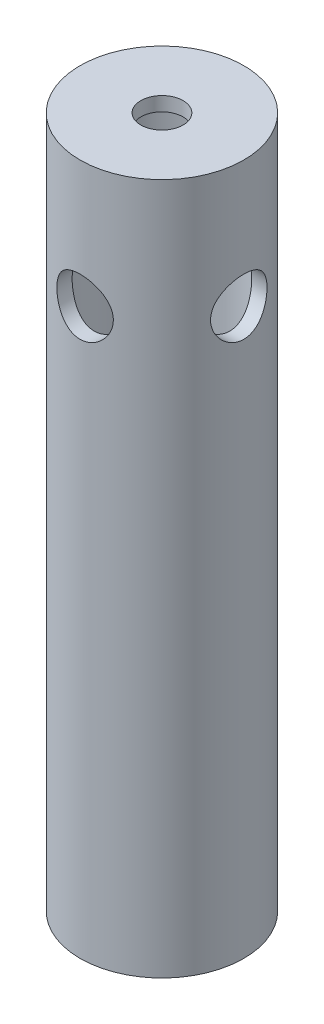
from build123d import *

# Parameters (mm, degrees)
SKETCH1_R           = 5.8
BOSS_EXTRUDE1_DEPTH = 49
SHELL2_T            = -1
SKETCH5_R           = 2
CUT_EXTRUDE1_DEPTH  = 50.681787407
CIRPATTERN1_COUNT   = 2
CIRPATTERN1_ANGLE   = 90
CUT_EXTRUDE2_REACH  = 51.682
SKETCH6_R           = 1.5


with BuildPart() as part:
    # Sketch1 → Boss-Extrude1 (new body)
    with BuildSketch(Plane(origin=(0, 0, 0), x_dir=(1, 0, 0), z_dir=(0, 1, 0))):
        with Locations(Location((0, 0, 0), (0, 0, 270))):
            Circle(SKETCH1_R)
    extrude(amount=BOSS_EXTRUDE1_DEPTH)

    # Shell2
    shell2_openings = [part.faces().sort_by_distance(p)[0] for p in [
        (0, 0, 0),
    ]]
    offset(amount=SHELL2_T, openings=shell2_openings, kind=Kind.INTERSECTION)

    # Sketch5 → Cut-Extrude1 (cut, symmetric)
    with BuildSketch(Plane.XY):
        with Locations((0, 40)):
            Circle(SKETCH5_R)
    cut_extrude1 = extrude(amount=CUT_EXTRUDE1_DEPTH, both=True, mode=Mode.SUBTRACT)

    # CirPattern1: Cut-Extrude1 ×2 about axis
    cirpattern1_axis = Axis((0, 49, 0), (0, -1, 0))
    for i in range(1, CIRPATTERN1_COUNT):
        add(cut_extrude1.rotate(cirpattern1_axis, i * CIRPATTERN1_ANGLE / (CIRPATTERN1_COUNT - 1)), mode=Mode.SUBTRACT)

    # Sketch6 → Cut-Extrude2 (cut, up to next)
    with BuildSketch(Plane(origin=(0, 49, 0), x_dir=(1, 0, 0), z_dir=(0, 1, 0)), mode=Mode.PRIVATE) as cut_extrude2_sk1:
        with Locations(Location((0, 0, 0), (0, 0, 270))):
            Circle(SKETCH6_R)
    cut_extrude2_tool1 = extrude(cut_extrude2_sk1.sketch, amount=-CUT_EXTRUDE2_REACH, mode=Mode.PRIVATE) & part.part
    add(cut_extrude2_tool1.solids().sort_by_distance((0, 49, 0))[0], mode=Mode.SUBTRACT)


solid = part.part
